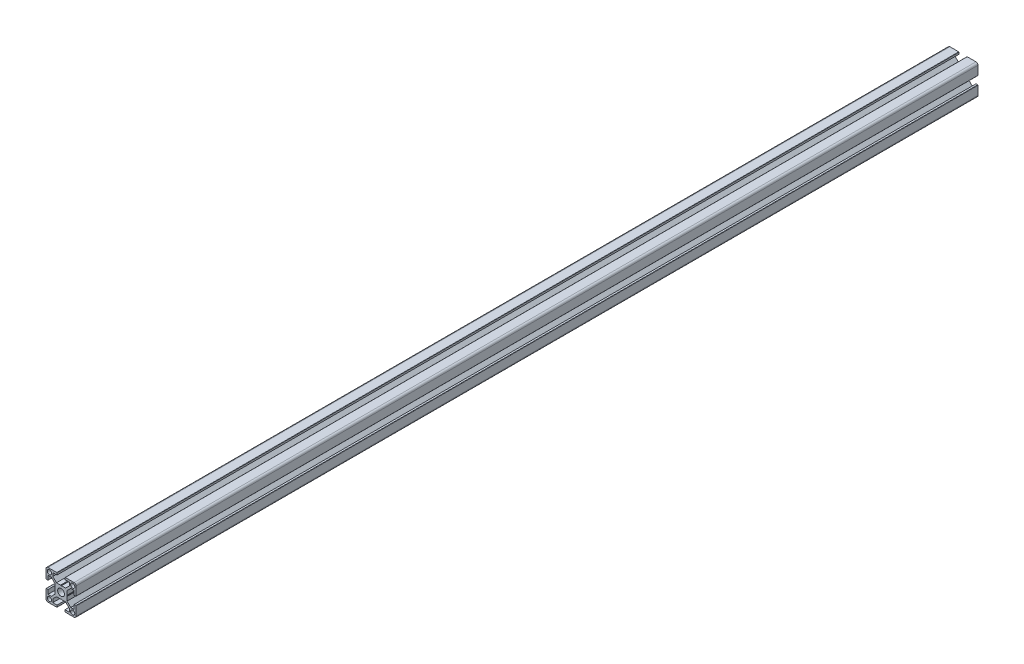
from build123d import *

# Parameters (mm, degrees)
SKETCH1_R           = 2.1
SKETCH1_R_2         = 3.4
BOSS_EXTRUDE1_DEPTH = 900


with BuildPart() as part:
    # Sketch1 → Boss-Extrude1 (new body)
    with BuildSketch(Plane.XY):
        with BuildLine():
            Line((-15, -4.3), (-15, -13))
            ThreePointArc((-15, -13), (-14.414213562, -14.414213562), (-13, -15))
            Line((-13, -15), (-4.3, -15))
            ThreePointArc((-4.3, -15), (-4.087867966, -14.912132034), (-4, -14.7))
            Line((-4, -14.7), (-4, -13))
            Line((-4, -13), (-8.249996, -13))
            Line((-8.249996, -13), (-8.249996, -9.664209562))
            Line((-8.249996, -9.664209562), (-4.585786438, -6))
            Line((-4.585786438, -6), (-0.519615242, -6))
            Line((-0.519615242, -6), (0, -5.7))
            Line((0, -5.7), (0.519615242, -6))
            Line((0.519615242, -6), (4.585786438, -6))
            Line((4.585786438, -6), (8.250004, -9.664217562))
            Line((8.250004, -9.664217562), (8.250004, -13))
            Line((8.250004, -13), (4, -13))
            Line((4, -13), (4, -14.7))
            ThreePointArc((4, -14.7), (4.087867966, -14.912132034), (4.3, -15))
            Line((4.3, -15), (13, -15))
            ThreePointArc((13, -15), (14.414213562, -14.414213562), (15, -13))
            Line((15, -13), (15, -4.3))
            ThreePointArc((15, -4.3), (14.912132034, -4.087867966), (14.7, -4))
            Line((14.7, -4), (13, -4))
            Line((13, -4), (13, -8.25))
            Line((13, -8.25), (9.664213562, -8.25))
            Line((9.664213562, -8.25), (6, -4.585786438))
            Line((6, -4.585786438), (6, -0.519615242))
            Line((6, -0.519615242), (5.7, 0))
            Line((5.7, 0), (6, 0.519615242))
            Line((6, 0.519615242), (6, 4.585786438))
            Line((6, 4.585786438), (9.664213562, 8.25))
            Line((9.664213562, 8.25), (13, 8.25))
            Line((13, 8.25), (13, 4))
            Line((13, 4), (14.7, 4))
            ThreePointArc((14.7, 4), (14.912132034, 4.087867966), (15, 4.3))
            Line((15, 4.3), (15, 13))
            ThreePointArc((15, 13), (14.414213562, 14.414213562), (13, 15))
            Line((13, 15), (4.3, 15))
            ThreePointArc((4.3, 15), (4.087867966, 14.912132034), (4, 14.7))
            Line((4, 14.7), (4, 13))
            Line((4, 13), (8.25, 13))
            Line((8.25, 13), (8.25, 9.664213562))
            Line((8.25, 9.664213562), (4.585786438, 6))
            Line((4.585786438, 6), (0.519615242, 6))
            Line((0.519615242, 6), (0, 5.7))
            Line((0, 5.7), (-0.519615242, 6))
            Line((-0.519615242, 6), (-4.585786438, 6))
            Line((-4.585786438, 6), (-8.25, 9.664213562))
            Line((-8.25, 9.664213562), (-8.25, 13))
            Line((-8.25, 13), (-4, 13))
            Line((-4, 13), (-4, 14.7))
            ThreePointArc((-4, 14.7), (-4.087867966, 14.912132034), (-4.3, 15))
            Line((-4.3, 15), (-13, 15))
            ThreePointArc((-13, 15), (-14.414213562, 14.414213562), (-15, 13))
            Line((-15, 13), (-15, 4.3))
            ThreePointArc((-15, 4.3), (-14.912132034, 4.087867966), (-14.7, 4))
            Line((-14.7, 4), (-13, 4))
            Line((-13, 4), (-13, 8.25))
            Line((-13, 8.25), (-9.664213562, 8.25))
            Line((-9.664213562, 8.25), (-6, 4.585786438))
            Line((-6, 4.585786438), (-6, 0.519615242))
            Line((-6, 0.519615242), (-5.7, 0))
            Line((-5.7, 0), (-6, -0.519615242))
            Line((-6, -0.519615242), (-6, -4.585786438))
            Line((-6, -4.585786438), (-9.664213562, -8.25))
            Line((-9.664213562, -8.25), (-13, -8.25))
            Line((-13, -8.25), (-13, -4))
            Line((-13, -4), (-14.7, -4))
            ThreePointArc((-14.7, -4), (-14.912132034, -4.087867966), (-15, -4.3))
        make_face()
        with Locations((11.625, -11.625)):
            Circle(SKETCH1_R, mode=Mode.SUBTRACT)
        with Locations((11.625, 11.625)):
            Circle(SKETCH1_R, mode=Mode.SUBTRACT)
        Circle(SKETCH1_R_2, mode=Mode.SUBTRACT)
        with Locations((-11.625, -11.625)):
            Circle(SKETCH1_R, mode=Mode.SUBTRACT)
        with Locations((-11.625, 11.625)):
            Circle(SKETCH1_R, mode=Mode.SUBTRACT)
    extrude(amount=-BOSS_EXTRUDE1_DEPTH)


solid = part.part
